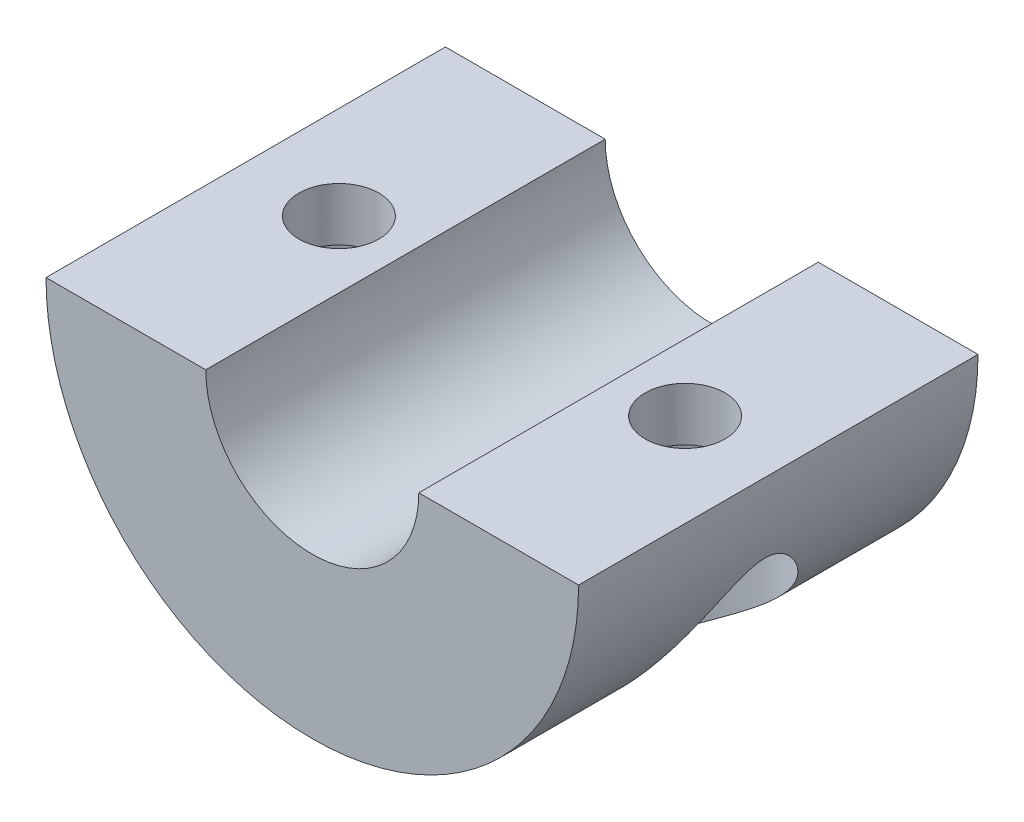
from build123d import *

# Parameters (mm, degrees)
BOSS_EXTRUDE1_DEPTH = 15
SKETCH2_R           = 3
CUT_EXTRUDE1_DEPTH  = 15
SKETCH3_R           = 1.5
CUT_EXTRUDE2_DEPTH  = 15


with BuildPart() as part:
    # Sketch1 → Boss-Extrude1 (new body)
    with BuildSketch(Plane.XY):
        with BuildLine():
            Line((10, 0), (4, 0))
            ThreePointArc((4, 0), (0, -4), (-4, 0))
            Line((-4, 0), (-10, 0))
            ThreePointArc((-10, 0), (0, -10), (10, 0))
        make_face()
    extrude(amount=BOSS_EXTRUDE1_DEPTH)

    # Sketch2 → Cut-Extrude1 (cut)
    with BuildSketch(Plane(origin=(0, -2, 0), x_dir=(1, 0, 0), z_dir=(0, 1, 0))):
        with Locations(Location((6.5, -7.5, 0), (0, 0, 270))):
            Circle(SKETCH2_R)
    cut_extrude1 = extrude(amount=-CUT_EXTRUDE1_DEPTH, mode=Mode.SUBTRACT)

    # Sketch3 → Cut-Extrude2 (cut)
    with BuildSketch(Plane.XZ.offset(2)):
        with Locations(Location((6.5, 7.5, 0), (0, 0, 270))):
            Circle(SKETCH3_R)
    cut_extrude2 = extrude(amount=-CUT_EXTRUDE2_DEPTH, mode=Mode.SUBTRACT)

    # Mirror1: Cut-Extrude1, Cut-Extrude2 across plane
    add(cut_extrude1.mirror(Plane(origin=(0, 0, 0), x_dir=(0, 0, 1), z_dir=(1, 0, 0))), mode=Mode.SUBTRACT)
    add(cut_extrude2.mirror(Plane(origin=(0, 0, 0), x_dir=(0, 0, 1), z_dir=(1, 0, 0))), mode=Mode.SUBTRACT)


solid = part.part
